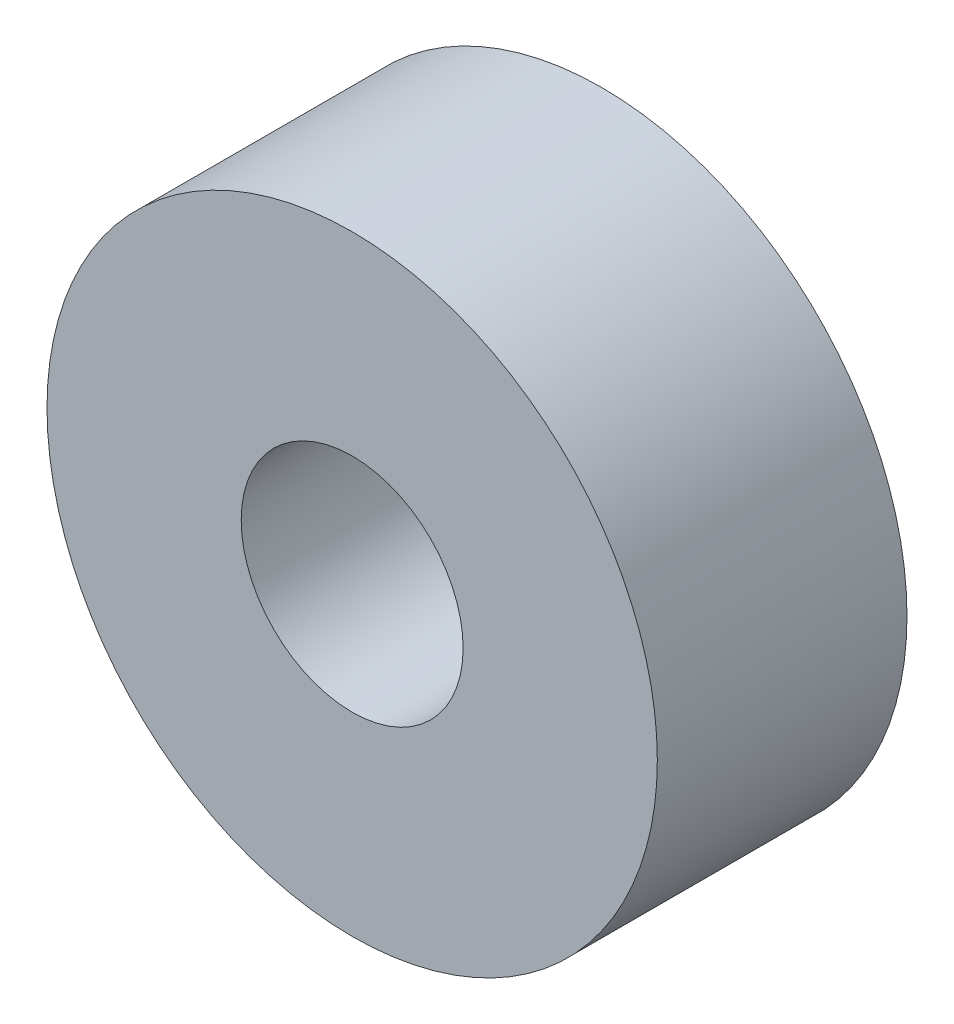
from build123d import *

# Parameters (mm, degrees)
SKETCH_1_R      = 22
SKETCH_1_R_2    = 8
EXTRUDE_1_DEPTH = 18


with BuildPart() as part:
    # 草图1 → 凸台-拉伸1 (new body)
    with BuildSketch(Plane.XY):
        Circle(SKETCH_1_R)
        Circle(SKETCH_1_R_2, mode=Mode.SUBTRACT)
    extrude(amount=EXTRUDE_1_DEPTH)


solid = part.part
